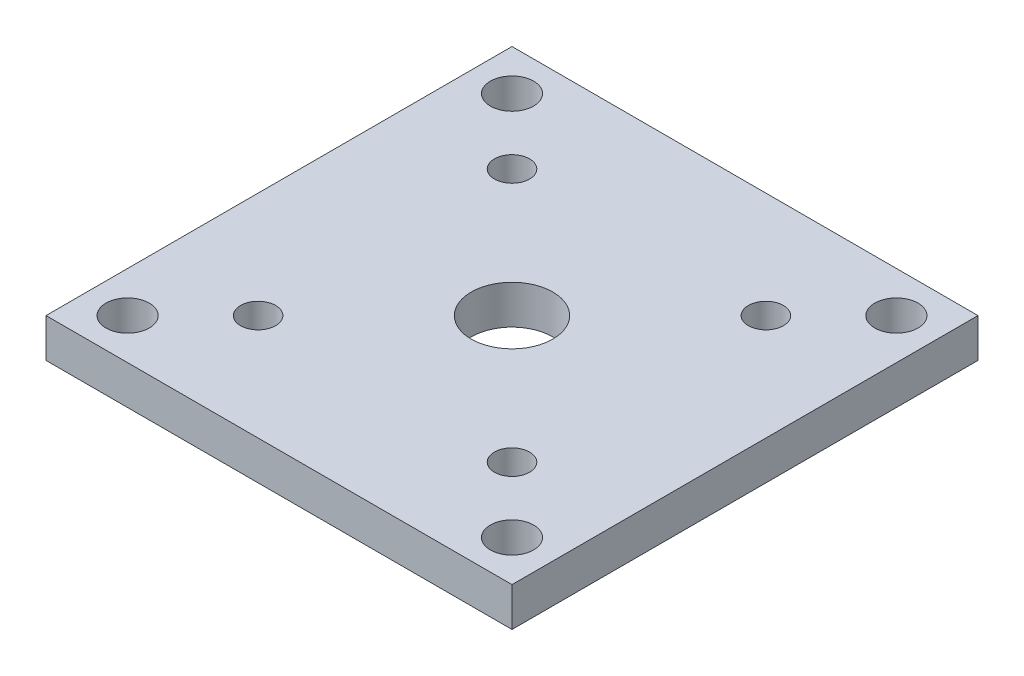
from build123d import *

# Parameters (mm, degrees)
SKETCH1_W           = 57.1
SKETCH1_H           = 57.1
SKETCH1_R           = 2.15
SKETCH1_R_2         = 2.65
SKETCH1_R_3         = 5
BOSS_EXTRUDE1_DEPTH = 4.7625


with BuildPart() as part:
    # Sketch1 → Boss-Extrude1 (new body)
    with BuildSketch(Plane(origin=(0, 0, 0), x_dir=(1, 0, 0), z_dir=(0, 1, 0))):
        with Locations((28.55, 28.55)):
            Rectangle(SKETCH1_W, SKETCH1_H)
        with Locations(Location((12.993650814, 44.106349186, 0), (0, 0, 90))):
            Circle(SKETCH1_R, mode=Mode.SUBTRACT)
        with Locations(Location((12.993650814, 12.993650814, 0), (0, 0, 90))):
            Circle(SKETCH1_R, mode=Mode.SUBTRACT)
        with Locations(Location((44.106349186, 12.993650814, 0), (0, 0, 90))):
            Circle(SKETCH1_R, mode=Mode.SUBTRACT)
        with Locations(Location((44.106349186, 44.106349186, 0), (0, 0, 90))):
            Circle(SKETCH1_R, mode=Mode.SUBTRACT)
        with Locations(Location((5, 52.1, 0), (0, 0, 90))):
            Circle(SKETCH1_R_2, mode=Mode.SUBTRACT)
        with Locations(Location((52.1, 52.1, 0), (0, 0, 90))):
            Circle(SKETCH1_R_2, mode=Mode.SUBTRACT)
        with Locations(Location((52.1, 5, 0), (0, 0, 90))):
            Circle(SKETCH1_R_2, mode=Mode.SUBTRACT)
        with Locations(Location((5, 5, 0), (0, 0, 90))):
            Circle(SKETCH1_R_2, mode=Mode.SUBTRACT)
        with Locations(Location((28.55, 28.55, 0), (0, 0, 90))):
            Circle(SKETCH1_R_3, mode=Mode.SUBTRACT)
    extrude(amount=BOSS_EXTRUDE1_DEPTH)


solid = part.part
